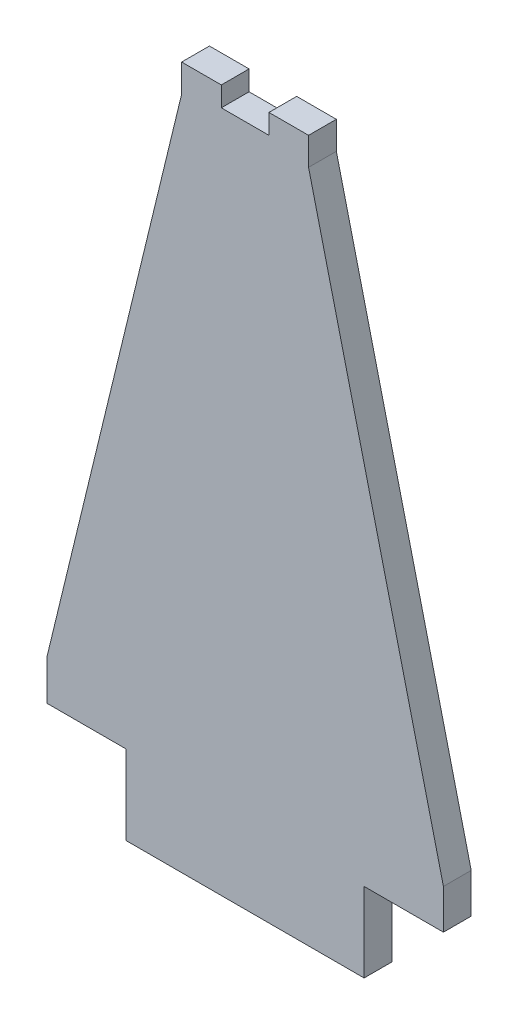
from build123d import *

# Parameters (mm, degrees)
BOSS_EXTRUDE1_DEPTH = 0.175


with BuildPart() as part:
    # frame_outline → Boss-Extrude1 (new, symmetric)
    with BuildSketch(Plane.XY):
        Polygon((0, 0), (3, 0), (3, 1), (4, 1), (4, 1.5), (2.3, 8.5), (2.3, 8.85), (1.8, 8.85), (1.8, 8.6), (1.2, 8.6), (1.2, 8.85), (0.7, 8.85), (0.7, 8.5), (-1, 1.5), (-1, 1), (0, 1), align=None)
    extrude(amount=BOSS_EXTRUDE1_DEPTH, both=True)


solid = part.part
